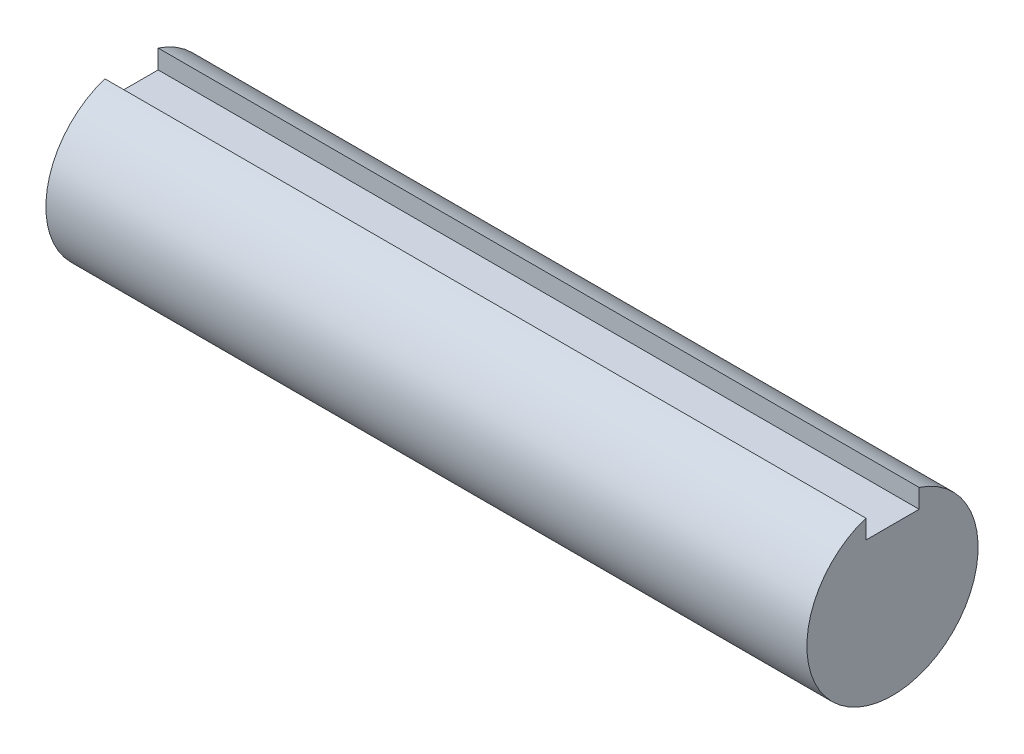
from build123d import *

# Parameters (mm, degrees)
BOSS_EXTRUDE1_DEPTH = 200


with BuildPart() as part:
    # Sketch2 → Boss-Extrude1 (new body)
    with BuildSketch(Plane(origin=(0, 0, 0), x_dir=(0, 0, -1), z_dir=(1, 0, 0))):
        with BuildLine():
            Line((-7, 21.38340478), (-7, 16.4))
            Line((-7, 16.4), (7, 16.4))
            Line((7, 16.4), (7, 21.38340478))
            ThreePointArc((7, 21.38340478), (0, -22.5), (-7, 21.38340478))
        make_face()
    extrude(amount=BOSS_EXTRUDE1_DEPTH)


solid = part.part
